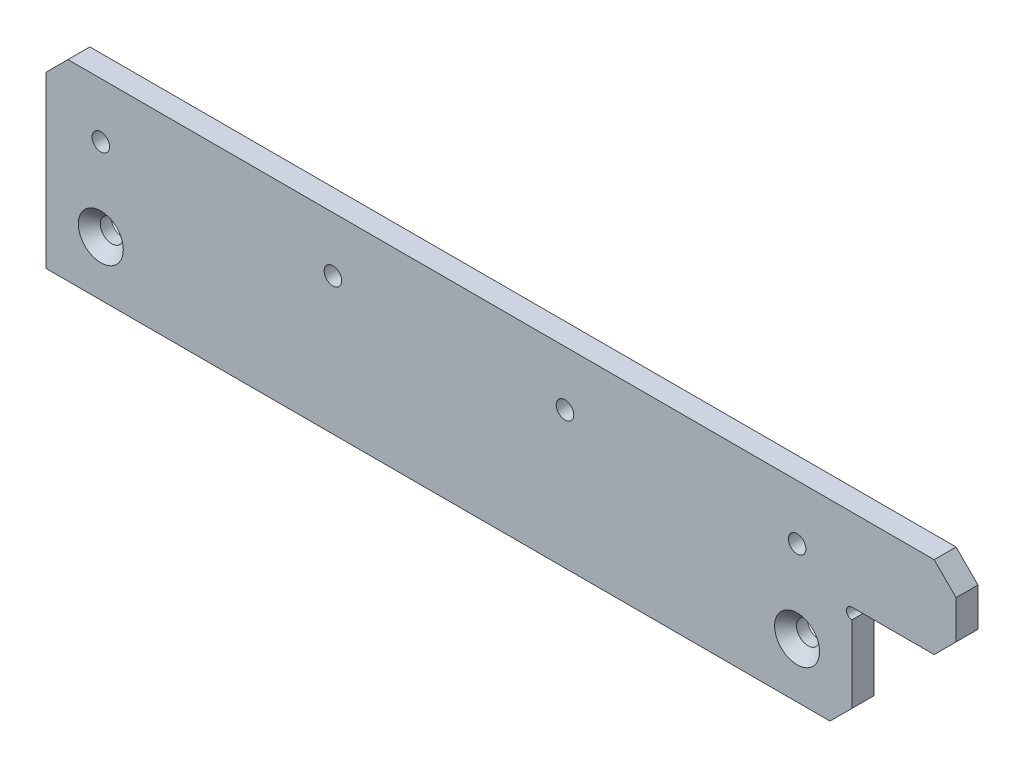
from build123d import *

# Parameters (mm, degrees)
SKETCH_1_W          = 147
SKETCH_1_H          = 35
EXTRUDE_1_DEPTH     = 2
SKETCH_2_W          = 19
SKETCH_2_H          = 15
EXTRUDE_2_DEPTH     = 4
SKETCH_3_R          = 2.1
CUT_EXTRUDE_1_DEPTH = 95.225792647
CHAMFER_1_SIZE      = 4
SKETCH_4_R          = 1
CUT_EXTRUDE_2_DEPTH = 95.225792647
SKETCH_5_R          = 1.6
CUT_EXTRUDE_3_DEPTH = 95.225792647
CHAMFER_2_SIZE      = 2


with BuildPart() as part:
    # 草图1 → 凸台-拉伸1 (new, symmetric)
    with BuildSketch(Plane.XY):
        Rectangle(SKETCH_1_W, SKETCH_1_H)
    extrude(amount=EXTRUDE_1_DEPTH, both=True)

    # 草图2 → 凸台-拉伸2 (add)
    with BuildSketch(Plane.XY.offset(2)):
        with Locations((83, 10)):
            Rectangle(SKETCH_2_W, SKETCH_2_H)
    extrude(amount=-EXTRUDE_2_DEPTH)

    # 草图3 → 切除-拉伸1 (cut, through all)
    with BuildSketch(Plane.XY.offset(2)):
        with Locations((-63.5, -7.5)):
            Circle(SKETCH_3_R)
        with Locations((63.5, -7.5)):
            Circle(SKETCH_3_R)
    extrude(amount=-CUT_EXTRUDE_1_DEPTH, mode=Mode.SUBTRACT)

    # 倒角1
    chamfer_1_edges = [part.edges().sort_by_distance(p)[0] for p in [
        (92.5, 17.5, 0),
        (92.5, 2.5, 0),
        (-73.5, 17.5, 0),
        (73.5, -17.5, 0),
    ]]
    chamfer(chamfer_1_edges, length=CHAMFER_1_SIZE)

    # 草图4 → 切除-拉伸2 (cut, through all)
    with BuildSketch(Plane.XY.offset(2)):
        with Locations((73.5, 1.5)):
            Circle(SKETCH_4_R)
    extrude(amount=-CUT_EXTRUDE_2_DEPTH, mode=Mode.SUBTRACT)

    # 草图5 → 切除-拉伸3 (cut, through all)
    with BuildSketch(Plane.XY.offset(2)):
        with Locations((-63.5, 7.5)):
            Circle(SKETCH_5_R)
        with Locations((-21.166666667, 7.5)):
            Circle(SKETCH_5_R)
        with Locations((21.166666667, 7.5)):
            Circle(SKETCH_5_R)
        with Locations((63.5, 7.5)):
            Circle(SKETCH_5_R)
    extrude(amount=-CUT_EXTRUDE_3_DEPTH, mode=Mode.SUBTRACT)

    # 倒角2
    chamfer_2_edges = [part.edges().sort_by_distance(p)[0] for p in [
        (-65.6, -7.5, 2),
        (61.4, -7.5, 2),
    ]]
    chamfer(chamfer_2_edges, length=CHAMFER_2_SIZE)


solid = part.part
